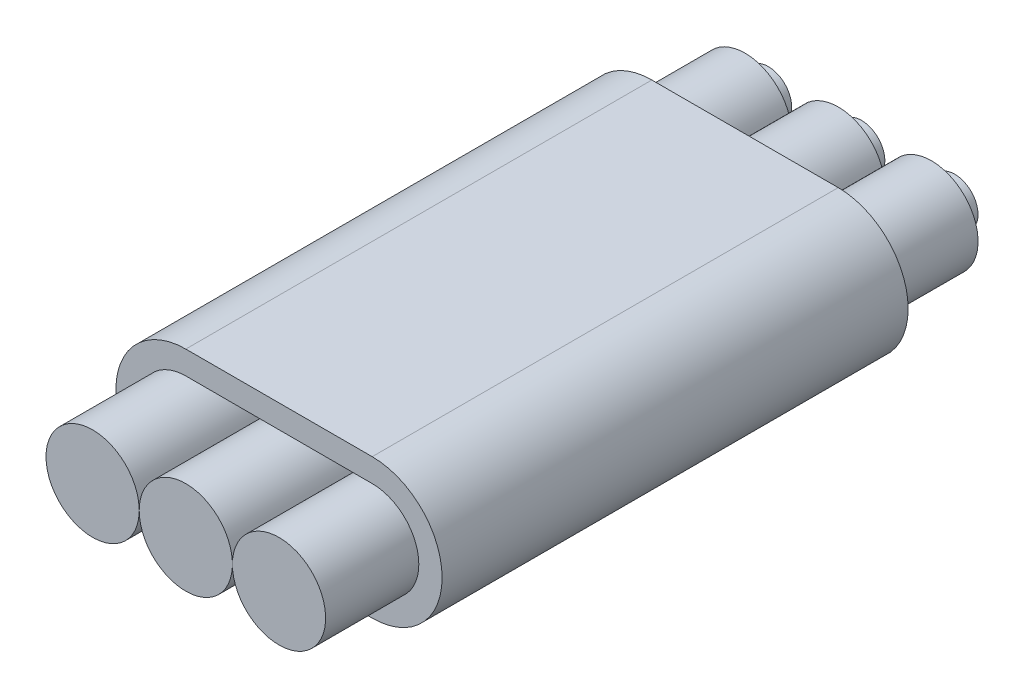
from build123d import *

# Parameters (mm, degrees)
EXTRUDE_THIN1_DEPTH      = 10
EXTRUDE_THIN2_DEPTH      = 2
EXTRUDE_THIN2_DEPTH_BACK = 12
SKETCH2_R                = 1
SKETCH2_R_2              = 0.5
BOSS_EXTRUDE1_DEPTH      = 0.5
BOSS_EXTRUDE1_DEPTH_BACK = 14
SKETCH3_R                = 0.5


with BuildPart() as part:
    # Sketch1 → Extrude-Thin1 (new body)
    with BuildSketch(Plane.XY):
        with BuildLine():
            Line((2, -1.5), (-2, -1.5))
            ThreePointArc((-2, -1.5), (-3.5, 0), (-2, 1.5))
            Line((-2, 1.5), (2, 1.5))
            ThreePointArc((2, 1.5), (3.5, 0), (2, -1.5))
        make_face()
        with BuildLine():
            Line((2, -1), (-2, -1))
            ThreePointArc((-2, -1), (-3, 0), (-2, 1))
            Line((-2, 1), (2, 1))
            ThreePointArc((2, 1), (3, 0), (2, -1))
        make_face(mode=Mode.SUBTRACT)
    extrude(amount=EXTRUDE_THIN1_DEPTH)

    # Sketch2 → Extrude-Thin2 (add, two sides: drawn at the far end of the back side and taken through both)
    # profile 1 of 3: a face of its own
    with BuildSketch(Plane(origin=(0, 0, 0), x_dir=(-1, 0, 0), z_dir=(0, 0, -1)).offset(-EXTRUDE_THIN2_DEPTH_BACK)):
        Circle(SKETCH2_R)
        Circle(SKETCH2_R_2, mode=Mode.SUBTRACT)
    # profile 2 of 3: a face of its own
    with BuildSketch(Plane(origin=(0, 0, 0), x_dir=(-1, 0, 0), z_dir=(0, 0, -1)).offset(-EXTRUDE_THIN2_DEPTH_BACK)):
        with Locations((2, 0)):
            Circle(SKETCH2_R)
        with Locations((2, 0)):
            Circle(SKETCH2_R_2, mode=Mode.SUBTRACT)
    # profile 3 of 3: a face of its own
    with BuildSketch(Plane(origin=(0, 0, 0), x_dir=(-1, 0, 0), z_dir=(0, 0, -1)).offset(-EXTRUDE_THIN2_DEPTH_BACK)):
        with Locations((-2, 0)):
            Circle(SKETCH2_R)
        with Locations((-2, 0)):
            Circle(SKETCH2_R_2, mode=Mode.SUBTRACT)
    extrude(amount=EXTRUDE_THIN2_DEPTH + EXTRUDE_THIN2_DEPTH_BACK)


with BuildPart() as extrude_thin2_piece_1:
    # of the separate pieces the step leaves, piece 1, a body of its own (extrude_thin2_pieces)
    add(part.part.solids().sort_by_distance((-2, 1.5, 0))[0])



with BuildPart() as extrude_thin2_piece_2:
    # of the separate pieces the step leaves, piece 2, a body of its own (extrude_thin2_pieces)
    add(part.part.solids().sort_by_distance((-0.5, 0, -2))[0])


with BuildPart() as extrude_thin2_piece_1_1:
    add(extrude_thin2_piece_1.part)

    add(extrude_thin2_piece_2.part)  # Boss-Extrude1 merges Extrude-Thin2 piece 2
    # Sketch3 → Boss-Extrude1 (add, two sides: drawn at the far end of the back side and taken through both)
    with BuildSketch(Plane(origin=(0, 0, -2), x_dir=(-1, 0, 0), z_dir=(0, 0, -1)).offset(-BOSS_EXTRUDE1_DEPTH_BACK)):
        with Locations((-2, 0)):
            Circle(SKETCH3_R)
        Circle(SKETCH3_R)
        with Locations((2, 0)):
            Circle(SKETCH3_R)
    extrude(amount=BOSS_EXTRUDE1_DEPTH + BOSS_EXTRUDE1_DEPTH_BACK)


solid = extrude_thin2_piece_1_1.part
